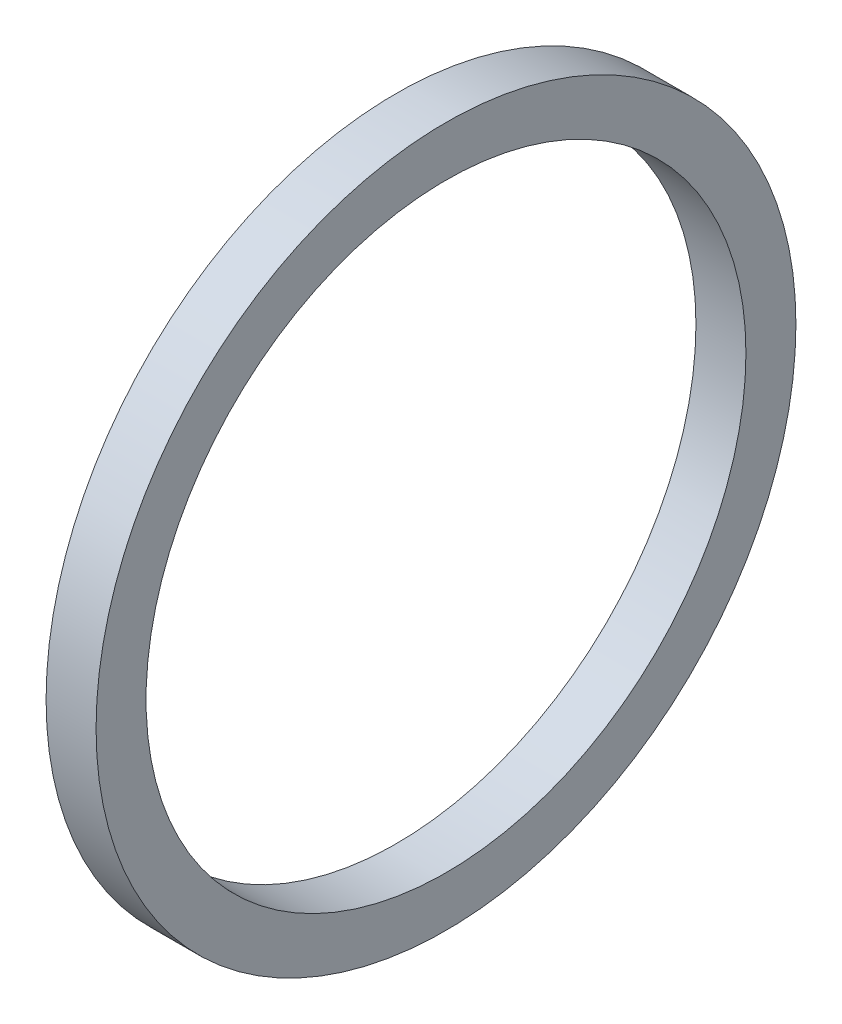
from build123d import *

# Parameters (mm, degrees)
SKETCH1_W = 12.7
SKETCH1_H = 12.7


with BuildPart() as part:
    # Sketch1 → Revolve1 (revolve)
    with BuildSketch(Plane.XY, mode=Mode.PRIVATE) as revolve1_sk:
        with Locations((-6.35, 82.55)):
            Rectangle(SKETCH1_W, SKETCH1_H)
    revolve(revolve1_sk.sketch.rotate(Axis((0, 0, 0), (-1, 0, 0)), 90), axis=Axis((0, 0, 0), (-1, 0, 0)))


solid = part.part
